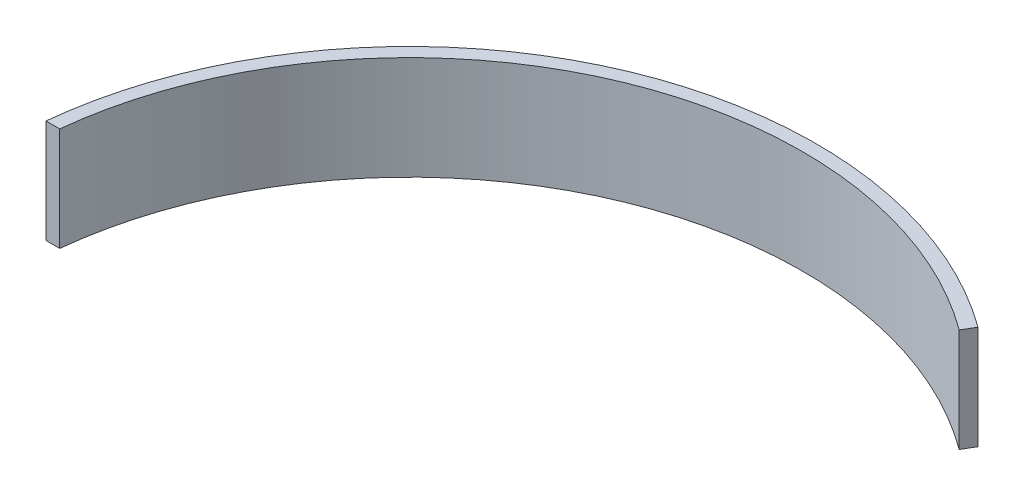
from build123d import *

# Parameters (mm, degrees)
BOSS_EXTRUDE1_DEPTH = 40


with BuildPart() as part:
    # Sketch1 → Boss-Extrude1 (new body)
    with BuildSketch(Plane(origin=(0, 0, 0), x_dir=(1, 0, 0), z_dir=(0, 1, 0))):
        with BuildLine():
            Line((-156.446657471, 16.116134878), (-151.143210885, 16.116134878))
            ThreePointArc((-151.143210885, 16.116134878), (-61.423475026, 139.036530148), (89.866102002, 122.589084796))
            Line((89.866102002, 122.589084796), (92.569104695, 127.146558322))
            ThreePointArc((92.569104695, 127.146558322), (-64.047046534, 143.642828807), (-156.446657471, 16.116134878))
        make_face()
    extrude(amount=BOSS_EXTRUDE1_DEPTH)


solid = part.part
